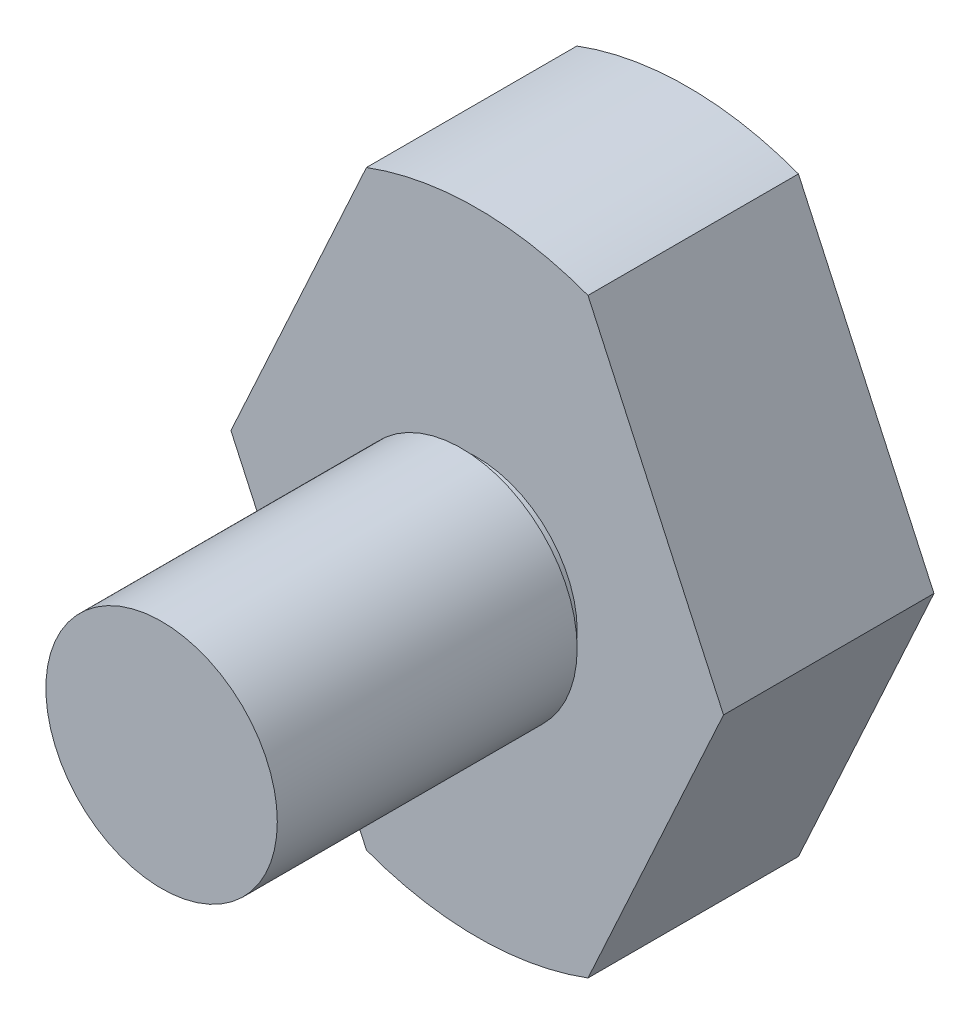
from build123d import *

# Parameters (mm, degrees)
CUT_EXTRUDE_START   = -30
SKETCH_2_R          = 36.239320701
CUT_EXTRUDE_1_DEPTH = 30


with BuildPart() as part:
    # 草图1 → 旋转1 (revolve)
    with BuildSketch(Plane(origin=(0, 0, 0), x_dir=(1, 0, 0), z_dir=(0, 1, 0))):
        Polygon((0, 0), (0, 50), (30, 50), (30, 30), (9.5, 30), (9.5, 28.5), (11, 28.5), (11, 0), align=None)
    revolve(axis=Axis((0, 0, 0), (0, 0, -1)))

    # 草图2 → 切除-拉伸1 (cut)
    with BuildSketch(Plane(origin=(0, 0, -50), x_dir=(-1, 0, 0), z_dir=(0, 0, -1)).offset(CUT_EXTRUDE_START)):
        Circle(SKETCH_2_R)
        with BuildLine():
            Line((-10.527630828, 28.092151736), (-23.409516673, 0))
            Line((-23.409516673, 0), (-10.527630828, -28.092151736))
            ThreePointArc((-10.527630828, -28.092151736), (0, -30), (10.527630828, -28.092151736))
            Line((10.527630828, -28.092151736), (23.409516673, 0))
            Line((23.409516673, 0), (10.527630828, 28.092151736))
            ThreePointArc((10.527630828, 28.092151736), (0, 30), (-10.527630828, 28.092151736))
        make_face(mode=Mode.SUBTRACT)
    extrude(amount=CUT_EXTRUDE_1_DEPTH, mode=Mode.SUBTRACT)


solid = part.part
